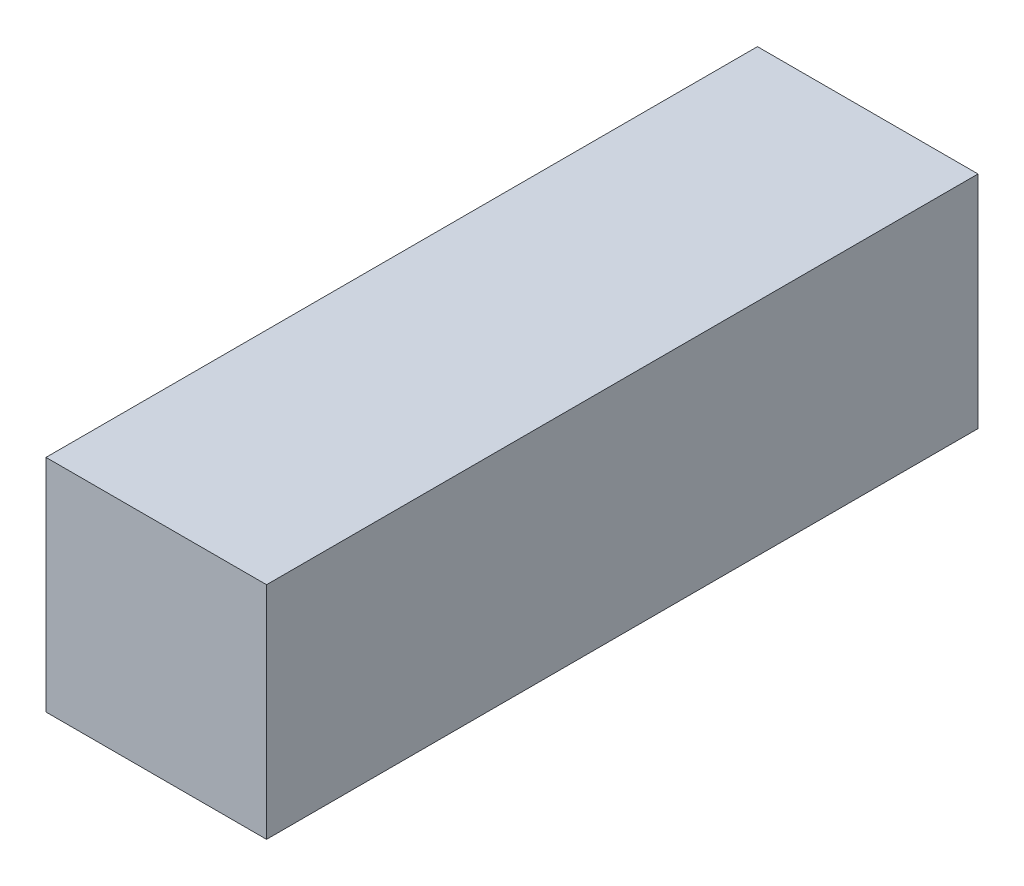
from build123d import *

# Parameters (mm, degrees)
SKETCH1_W           = 6.2
SKETCH1_H           = 6.2
BOSS_EXTRUDE1_DEPTH = 20


with BuildPart() as part:
    # Sketch1 → Boss-Extrude1 (new body)
    with BuildSketch(Plane.XY):
        Rectangle(SKETCH1_W, SKETCH1_H)
    extrude(amount=BOSS_EXTRUDE1_DEPTH)


solid = part.part
